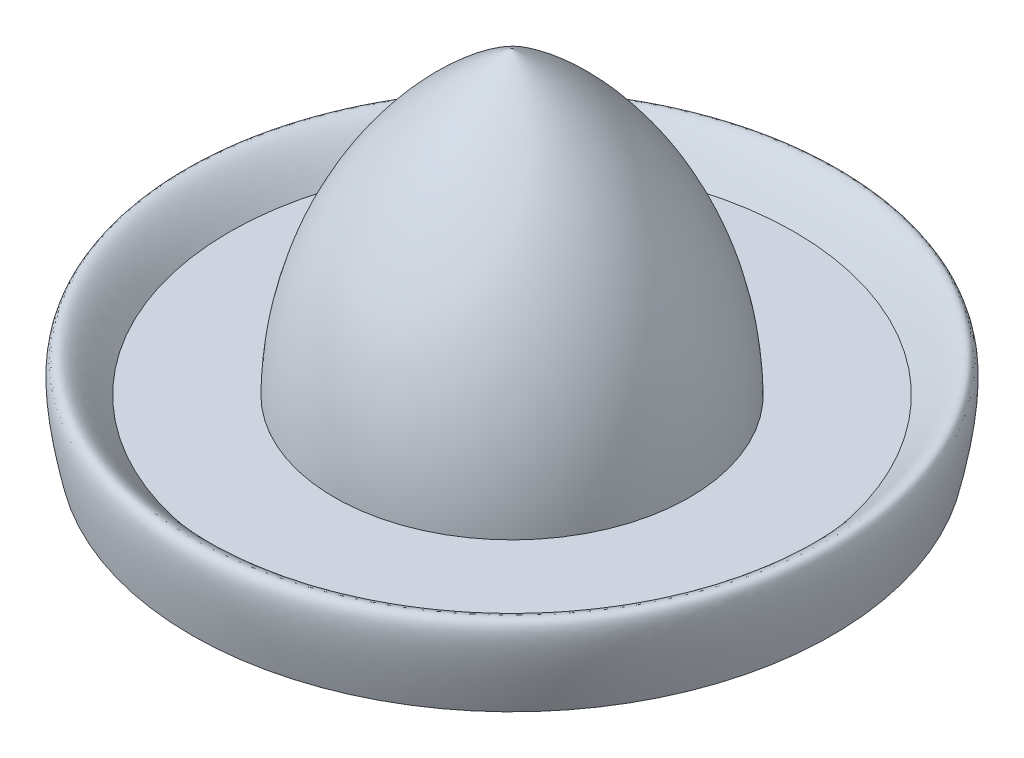
from build123d import *


with BuildPart() as part:
    # Sketch1 → Revolve1 (revolve)
    with BuildSketch(Plane(origin=(0, 0, 0), x_dir=(0, 0, -1), z_dir=(1, 0, 0))):
        with BuildLine():
            Line((12.674462721, 0), (15.361031075, 0))
            Line((15.361031075, 0), (27.700219971, 0))
            add(Edge.make_bspline(
                [(27.700219971, 0), (30.337016271, 11.838417891), (24.426557611, 4.155032996)],
                knots=[0, 0, 0, 1, 1, 1], degree=2))
            Line((24.426557611, 4.155032996), (15.361031075, 4.155032996))
            ThreePointArc((15.361031075, 4.155032996), (11.135999284, 19.170223885), (0, 30.092511696))
            Line((0, 30.092511696), (0, 27.57430988))
            ThreePointArc((0, 27.57430988), (9.846146436, 15.400018997), (12.674462721, 0))
        make_face()
    revolve(axis=Axis((0, 0, 0), (0, 1, 0)))


solid = part.part
